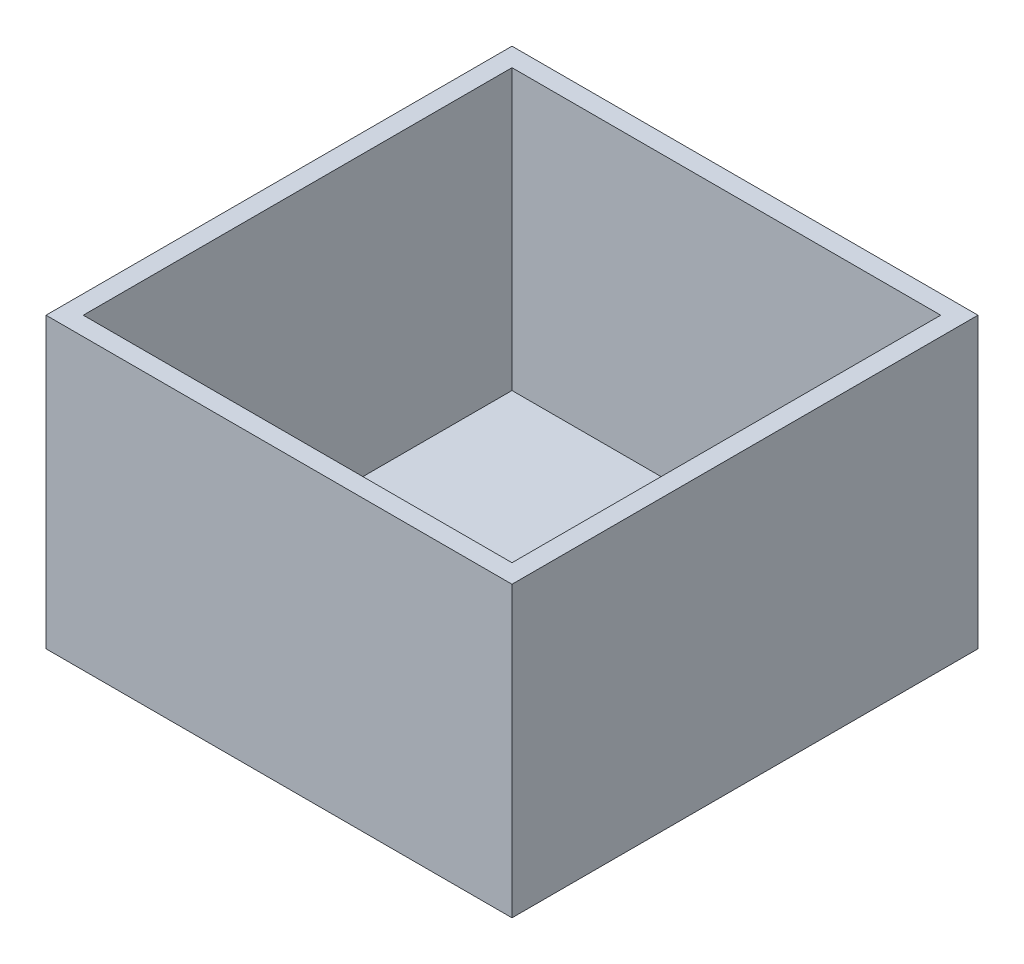
from build123d import *

# Parameters (mm, degrees)
IZIM1_W                     = 50
IZIM1_H                     = 50
IZIM1_W_2                   = 46
IZIM1_H_2                   = 46
Y_KSEKLIK_EKSTR_ZYON1_DEPTH = 30
IZIM2_W                     = 50
IZIM2_H                     = 50
Y_KSEKLIK_EKSTR_ZYON2_DEPTH = 1


with BuildPart() as part:
    # Çizim1 → Yükseklik-Ekstrüzyon1 (new body)
    with BuildSketch(Plane(origin=(0, 0, 0), x_dir=(1, 0, 0), z_dir=(0, 1, 0))):
        Rectangle(IZIM1_W, IZIM1_H)
        Rectangle(IZIM1_W_2, IZIM1_H_2, mode=Mode.SUBTRACT)
    extrude(amount=Y_KSEKLIK_EKSTR_ZYON1_DEPTH)

    # Çizim2 → Yükseklik-Ekstrüzyon2 (add)
    with BuildSketch(Plane.XZ):
        Rectangle(IZIM2_W, IZIM2_H)
    extrude(amount=Y_KSEKLIK_EKSTR_ZYON2_DEPTH)


solid = part.part
